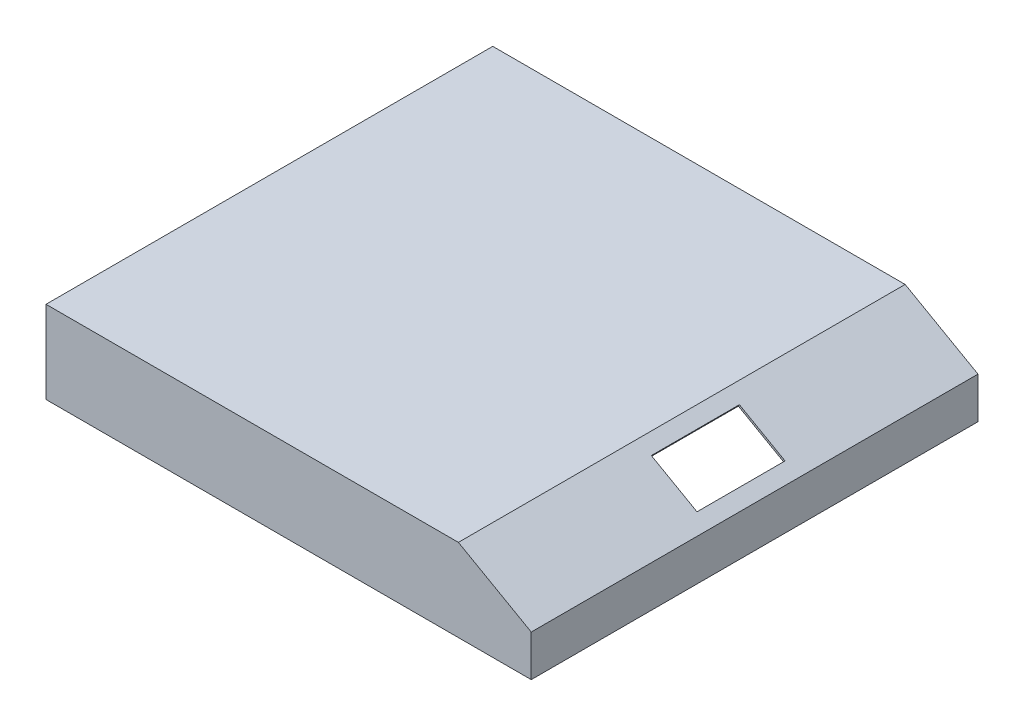
from build123d import *

# Parameters (mm, degrees)
SALIENTE_EXTRUIR1_DEPTH = 325
VACIADO1_T              = -3
CROQUIS2_W              = 76.381162613
CROQUIS2_H              = 128.156475552
CORTAR_EXTRUIR1_DEPTH   = 697.992520796


with BuildPart() as part:
    # Croquis1 → Saliente-Extruir1 (new, symmetric)
    with BuildSketch(Plane.XY):
        Polygon((0, 0), (0, 120), (600, 120), (705.985097206, 60), (705.985097206, 0), align=None)
    extrude(amount=SALIENTE_EXTRUIR1_DEPTH, both=True)

    # Vaciado1
    vaciado1_openings = [part.faces().sort_by_distance(p)[0] for p in [
        (352.992548603, 0, 0),
    ]]
    offset(amount=VACIADO1_T, openings=vaciado1_openings, kind=Kind.INTERSECTION)

    # Croquis2 → Cortar-Extruir1 (cut, through all)
    with BuildSketch(Plane(origin=(197.068972386, 348.106236577, 0), x_dir=(0.8702271613704161, -0.4926506750357577, 0), z_dir=(0.4926506750357577, 0.8702271613704161, 0))):
        with Locations((523.913291213, 0)):
            Rectangle(CROQUIS2_W, CROQUIS2_H)
    extrude(amount=-CORTAR_EXTRUIR1_DEPTH, mode=Mode.SUBTRACT)


solid = part.part
